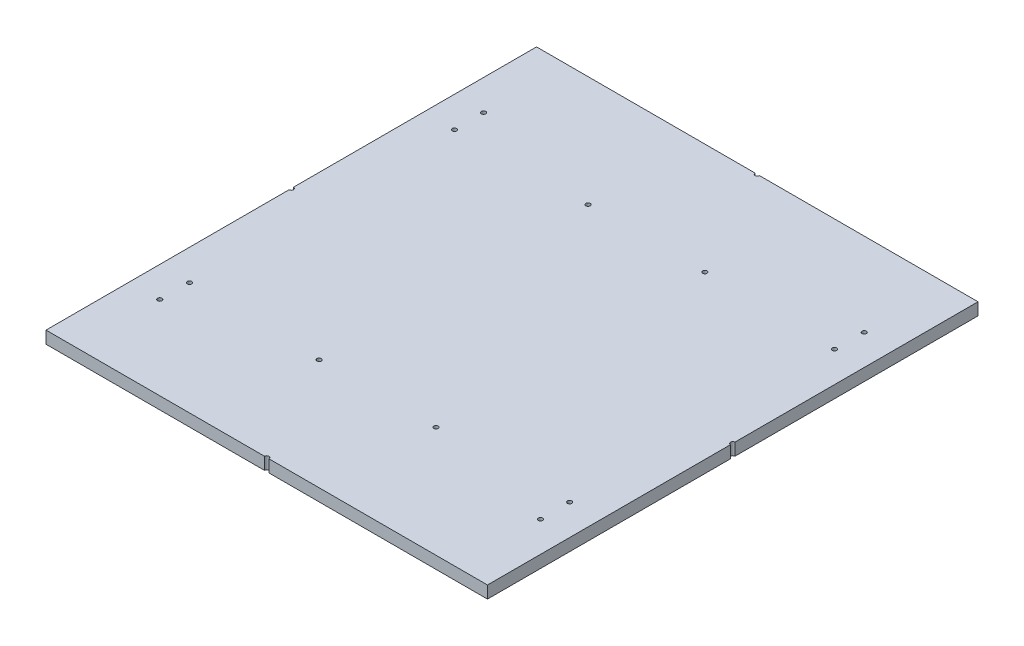
from build123d import *

# Parameters (mm, degrees)
SKETCH1_W             = 228.6
SKETCH1_H             = 254
BOSS_EXTRUDE1_DEPTH   = 6.35
F_4_40_TAPPED_HOLE1_D = 2.2606


with BuildPart() as part:
    # Sketch1 → Boss-Extrude1 (new body)
    with BuildSketch(Plane(origin=(0, 0, 0), x_dir=(1, 0, 0), z_dir=(0, 1, 0))):
        with Locations((114.3, 127)):
            Rectangle(SKETCH1_W, SKETCH1_H)
    extrude(amount=BOSS_EXTRUDE1_DEPTH)

    # #4-40 Tapped Hole1 (through all)
    with Locations(Plane(origin=(0, 6.35, 0), x_dir=(1, 0, 0), z_dir=(0, 1, 0))):
        with Locations((15.735159407, 43.18), (15.875, 58.42), (84.05884141, 57.388437181), (144.561688198, 57.388437181), (0, 127), (144.561688198, 196.611562819), (84.05884141, 196.611562819), (15.875, 195.58), (15.735159407, 210.82), (114.3, 0), (212.864840593, 43.18), (212.725, 58.42), (212.864840593, 210.82), (212.725, 195.58), (228.6, 127), (114.3, 254)):
            Hole(F_4_40_TAPPED_HOLE1_D / 2)


solid = part.part
